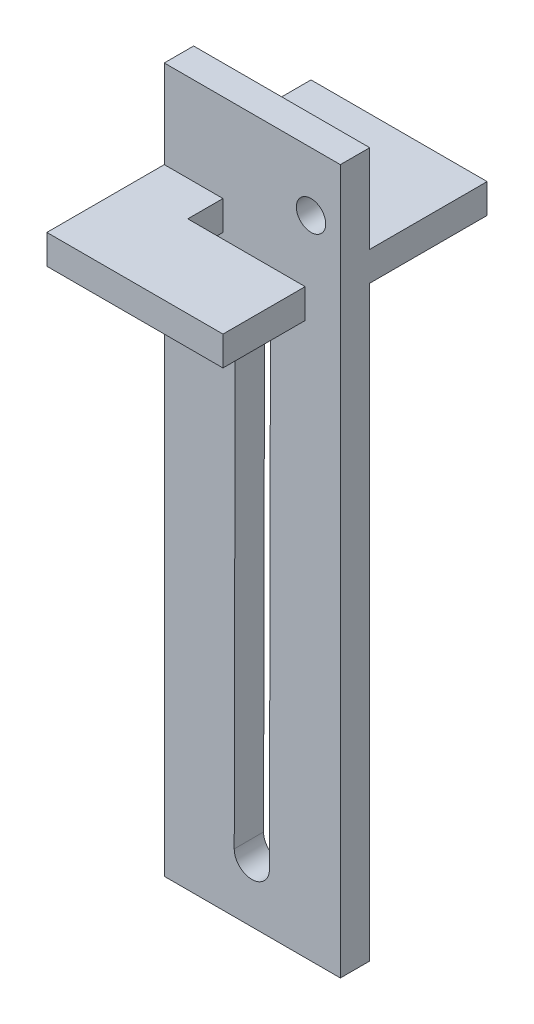
from build123d import *

# Parameters (mm, degrees)
SKETCH1_W           = 30
SKETCH1_H           = 100
BOSS_EXTRUDE1_DEPTH = 5
SKETCH2_W           = 30
SKETCH2_H           = 45
BOSS_EXTRUDE2_DEPTH = 5
SKETCH3_W           = 30
SKETCH3_H           = 5
BOSS_EXTRUDE3_DEPTH = 15
SKETCH4_R           = 2.5
CUT_EXTRUDE1_DEPTH  = 8
SKETCH5_W           = 6
SKETCH5_H           = 5
CUT_EXTRUDE2_DEPTH  = 20


with BuildPart() as part:
    # Sketch1 → Boss-Extrude1 (new body)
    with BuildSketch(Plane.XY):
        with Locations((11.532089338, -8.646905221)):
            Rectangle(SKETCH1_W, SKETCH1_H)
        with BuildLine():
            Line((14.615865264, 31.346811585), (14.448313411, -48.653188415))
            ThreePointArc((14.448313411, -48.653188415), (11.442030217, -51.646905221), (8.448313411, -48.640622026))
            Line((8.448313411, -48.640622026), (8.615865264, 31.359377974))
            ThreePointArc((8.615865264, 31.359377974), (11.622148459, 34.353094779), (14.615865264, 31.346811585))
        make_face(mode=Mode.SUBTRACT)
    extrude(amount=BOSS_EXTRUDE1_DEPTH)

    # Sketch2 → Boss-Extrude2 (add)
    with BuildSketch(Plane(origin=(0, 41.353094779, 0), x_dir=(1, 0, 0), z_dir=(0, 1, 0))):
        with Locations((11.532089338, -2.5)):
            Rectangle(SKETCH2_W, SKETCH2_H)
    extrude(amount=BOSS_EXTRUDE2_DEPTH)

    # Sketch3 → Boss-Extrude3 (add)
    with BuildSketch(Plane(origin=(0, 46.353094779, 0), x_dir=(1, 0, 0), z_dir=(0, 1, 0))):
        with Locations((11.532089338, -2.5)):
            Rectangle(SKETCH3_W, SKETCH3_H)
    extrude(amount=BOSS_EXTRUDE3_DEPTH)

    # Sketch4 → Cut-Extrude1 (cut)
    with BuildSketch(Plane.XY.offset(5)):
        with Locations((21.532089338, 51.353094779)):
            Circle(SKETCH4_R)
    extrude(amount=-CUT_EXTRUDE1_DEPTH, mode=Mode.SUBTRACT)

    # Sketch5 → Cut-Extrude2 (cut)
    with BuildSketch(Plane(origin=(26.532089338, 0, 0), x_dir=(0, 0, -1), z_dir=(1, 0, 0))):
        with Locations((-8, 43.853094779)):
            Rectangle(SKETCH5_W, SKETCH5_H)
    extrude(amount=-CUT_EXTRUDE2_DEPTH, mode=Mode.SUBTRACT)


solid = part.part
